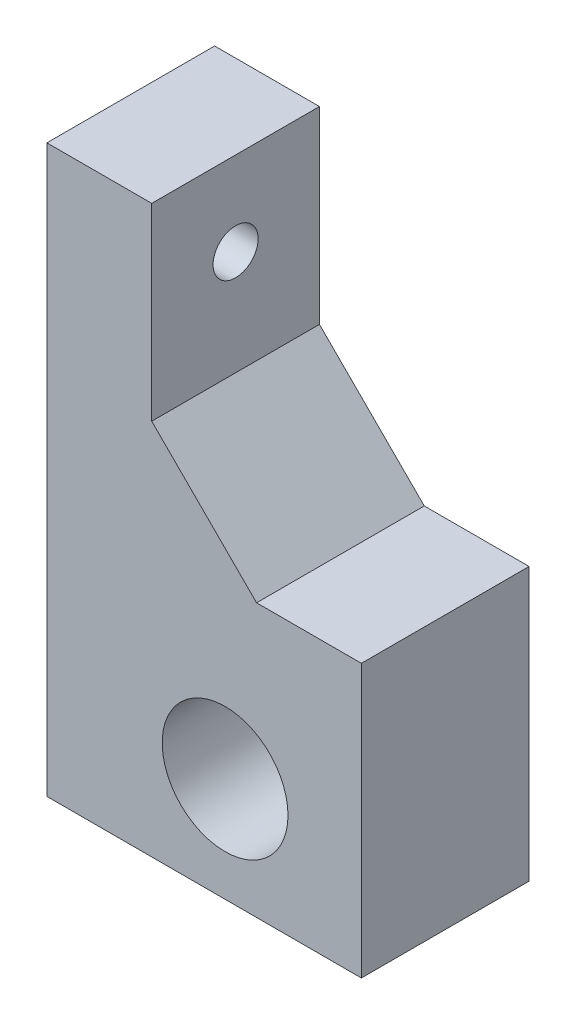
from build123d import *

# Parameters (mm, degrees)
SKETCH1_W           = 16
SKETCH1_H           = 48
SKETCH1_R           = 2.15
SKETCH1_R_2         = 1.75
BOSS_EXTRUDE1_DEPTH = 10
SKETCH2_R           = 6
BOSS_EXTRUDE2_DEPTH = 16
CHAMFER1_SIZE       = 10


with BuildPart() as part:
    # Sketch1 → Boss-Extrude1 (new body)
    with BuildSketch(Plane(origin=(0, 0, 0), x_dir=(0, 0, -1), z_dir=(1, 0, 0))):
        with Locations((8, 24)):
            Rectangle(SKETCH1_W, SKETCH1_H)
        with Locations((8, 40)):
            Circle(SKETCH1_R, mode=Mode.SUBTRACT)
        with Locations((8, 8)):
            Circle(SKETCH1_R_2, mode=Mode.SUBTRACT)
    extrude(amount=BOSS_EXTRUDE1_DEPTH)

    # Sketch2 → Boss-Extrude2 (add, through all)
    with BuildSketch(Plane.XY):
        Polygon((10, 20), (10, 0), (0, 0), (0, -6), (30, -6), (30, 20), align=None)
        with Locations((17, 3.936401072)):
            Circle(SKETCH2_R, mode=Mode.SUBTRACT)
    extrude(amount=-BOSS_EXTRUDE2_DEPTH)

    # Chamfer1
    chamfer1_edges = [part.edges().sort_by_distance(p)[0] for p in [
        (10, 20, -8),
    ]]
    chamfer(chamfer1_edges, length=CHAMFER1_SIZE)


solid = part.part
